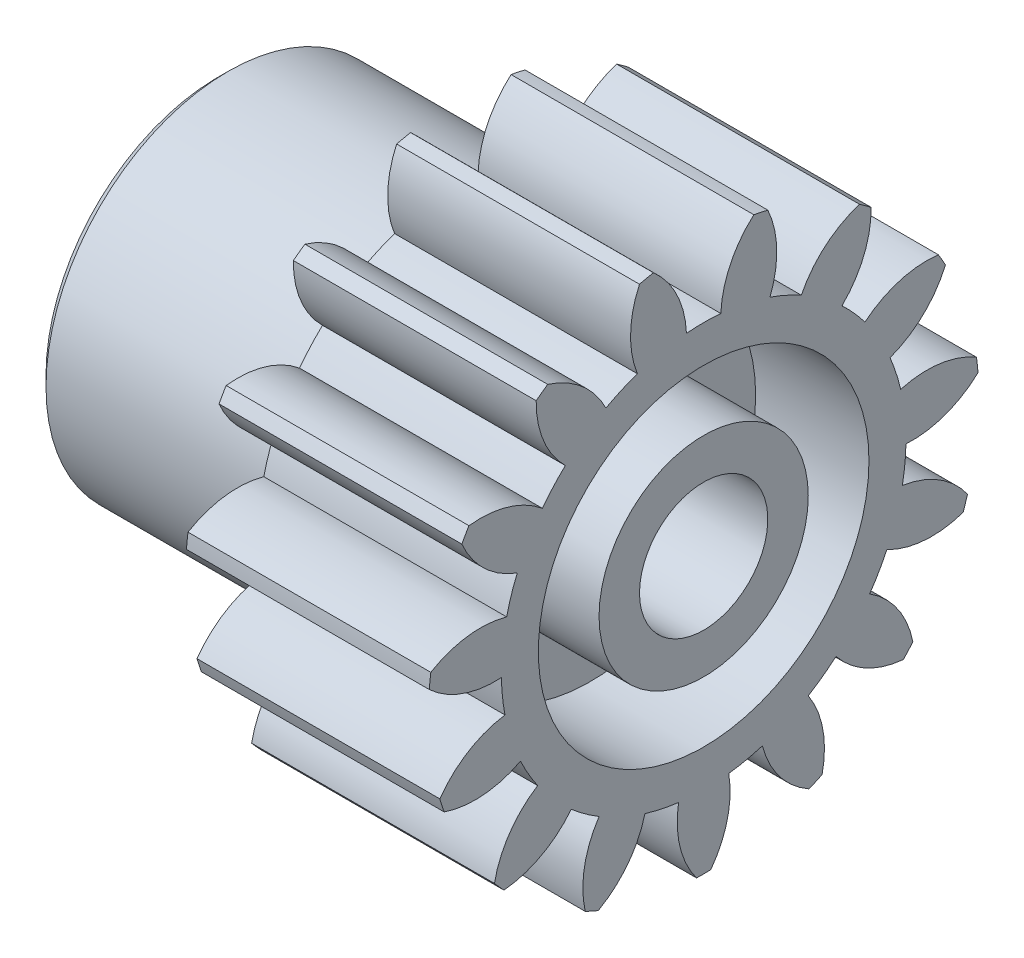
from build123d import *

# Parameters (mm, degrees)
BASPROSKE_W             = 6
BASPROSKE_H             = 6.8
TOOTHCUT_DEPTH          = 12.334901852
TEETHCUTS_COUNT         = 15
TEETHCUTS_ANGLE         = 336
BORSKE_R                = 0.4
BORE_DEPTH              = 50.0000508
ESQUISSE1_R             = 4.5
BOSS_EXTRU_1_DEPTH      = 6
ENL_V_MAT_EXTRU_1_REACH = 17.369
ESQUISSE2_R             = 1.585
ESQUISSE3_R             = 4.085
ESQUISSE3_R_2           = 2.585
ENL_V_MAT_EXTRU_2_DEPTH = 2.8
CHANFREIN1_SIZE         = 0.25


with BuildPart() as part:
    # BasProSke → Base-Revolve (revolve)
    with BuildSketch(Plane(origin=(0, 0, 0), x_dir=(1, 0, 0), z_dir=(0, 1, 0)), mode=Mode.PRIVATE) as base_revolve_sk:
        with Locations((3, 3.4)):
            Rectangle(BASPROSKE_W, BASPROSKE_H)
    revolve(base_revolve_sk.sketch.rotate(Axis((-10, 0, 0), (1, 0, 0)), 180), axis=Axis((-10, 0, 0), (1, 0, 0)))

    # TooCutSke → ToothCut (cut, through all)
    with BuildSketch(Plane(origin=(0, 0, 0), x_dir=(0, 0, -1), z_dir=(1, 0, 0))):
        with BuildLine():
            ThreePointArc((0.424668738, 4.980929377), (0, 4.999), (-0.424668738, 4.980929377))
            ThreePointArc((-0.424668738, 4.980929377), (-0.664927989, 5.931738726), (-1.265455885, 6.70706393))
            ThreePointArc((-1.265455885, 6.70706393), (0, 6.8254), (1.265455885, 6.70706393))
            ThreePointArc((1.265455885, 6.70706393), (0.664927989, 5.931738726), (0.424668738, 4.980929377))
        make_face()
    toothcut = extrude(amount=TOOTHCUT_DEPTH, mode=Mode.SUBTRACT)

    # TeethCuts: ToothCut ×15 about axis
    teethcuts_axis = Axis((-10, 0, 0), (1, 0, 0))
    for i in range(1, TEETHCUTS_COUNT):
        add(toothcut.rotate(teethcuts_axis, i * TEETHCUTS_ANGLE / (TEETHCUTS_COUNT - 1)), mode=Mode.SUBTRACT)

    # BorSke → Bore (cut, symmetric)
    with BuildSketch(Plane(origin=(0, 0, 0), x_dir=(0, 0, -1), z_dir=(1, 0, 0))):
        with Locations(Location((0, 0, 0), (0, 0, 180))):
            Circle(BORSKE_R)
    extrude(amount=BORE_DEPTH, both=True, mode=Mode.SUBTRACT)

    # Esquisse1 → Boss.-Extru.1 (add)
    with BuildSketch(Plane.ZY):
        with Locations(Location((0, 0, 0), (0, 0, 180))):
            Circle(ESQUISSE1_R)
    extrude(amount=BOSS_EXTRU_1_DEPTH)

    # Esquisse2 → Enlèv. mat.-Extru.1 (cut, up to next)
    with BuildSketch(Plane.ZY.offset(6), mode=Mode.PRIVATE) as enl_v_mat_extru_1_sk1:
        Circle(ESQUISSE2_R)
    enl_v_mat_extru_1_tool1 = extrude(enl_v_mat_extru_1_sk1.sketch, amount=-ENL_V_MAT_EXTRU_1_REACH, mode=Mode.PRIVATE) & part.part
    add(enl_v_mat_extru_1_tool1.solids().sort_by_distance((-6, 0, 0))[0], mode=Mode.SUBTRACT)

    # Esquisse3 → Enlèv. mat.-Extru.2 (cut)
    with BuildSketch(Plane(origin=(6, 0, 0), x_dir=(0, 0, -1), z_dir=(1, 0, 0))):
        Circle(ESQUISSE3_R)
        Circle(ESQUISSE3_R_2, mode=Mode.SUBTRACT)
    extrude(amount=-ENL_V_MAT_EXTRU_2_DEPTH, mode=Mode.SUBTRACT)

    # Chanfrein1
    chanfrein1_edges = [part.edges().sort_by_distance(p)[0] for p in [
        (-6, 0, 4.5),
    ]]
    chamfer(chanfrein1_edges, length=CHANFREIN1_SIZE)


solid = part.part
